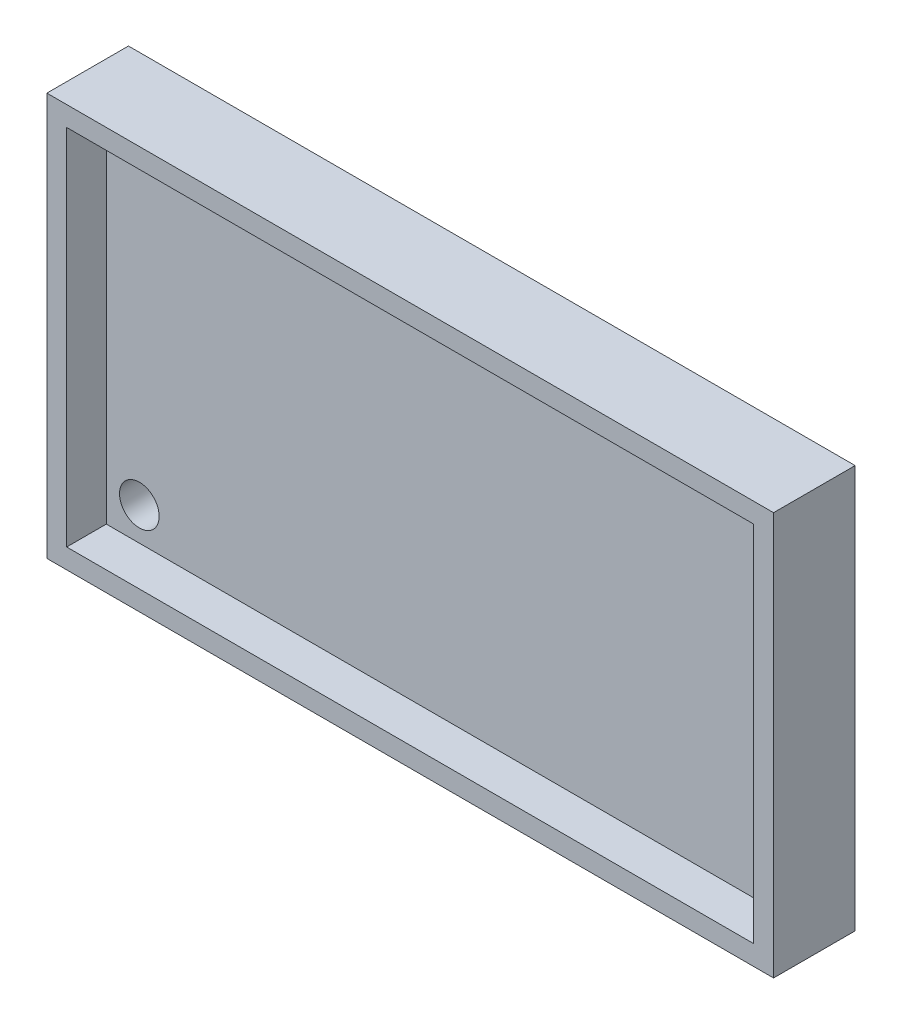
from build123d import *

# Parameters (mm, degrees)
SKETCH1_W           = 110
SKETCH1_H           = 61
BOSS_EXTRUDE1_DEPTH = 6.35
SKETCH3_W           = 110
SKETCH3_H           = 61
SKETCH3_W_2         = 104
SKETCH3_H_2         = 55
BOSS_EXTRUDE2_DEPTH = 6
SKETCH5_R           = 3
CUT_EXTRUDE1_DEPTH  = 126.941742484


with BuildPart() as part:
    # Sketch1 → Boss-Extrude1 (new body)
    with BuildSketch(Plane.XY):
        with Locations((55, 30.5)):
            Rectangle(SKETCH1_W, SKETCH1_H)
    extrude(amount=BOSS_EXTRUDE1_DEPTH)

    # Sketch3 → Boss-Extrude2 (add)
    with BuildSketch(Plane.XY.offset(6.35)):
        with Locations((55, 30.5)):
            Rectangle(SKETCH3_W, SKETCH3_H)
        with Locations((55, 30.5)):
            Rectangle(SKETCH3_W_2, SKETCH3_H_2, mode=Mode.SUBTRACT)
    extrude(amount=BOSS_EXTRUDE2_DEPTH)

    # Sketch5 → Cut-Extrude1 (cut, through all)
    with BuildSketch(Plane.XY.offset(6.35)):
        with Locations((8, 8)):
            Circle(SKETCH5_R)
    extrude(amount=-CUT_EXTRUDE1_DEPTH, mode=Mode.SUBTRACT)


solid = part.part
